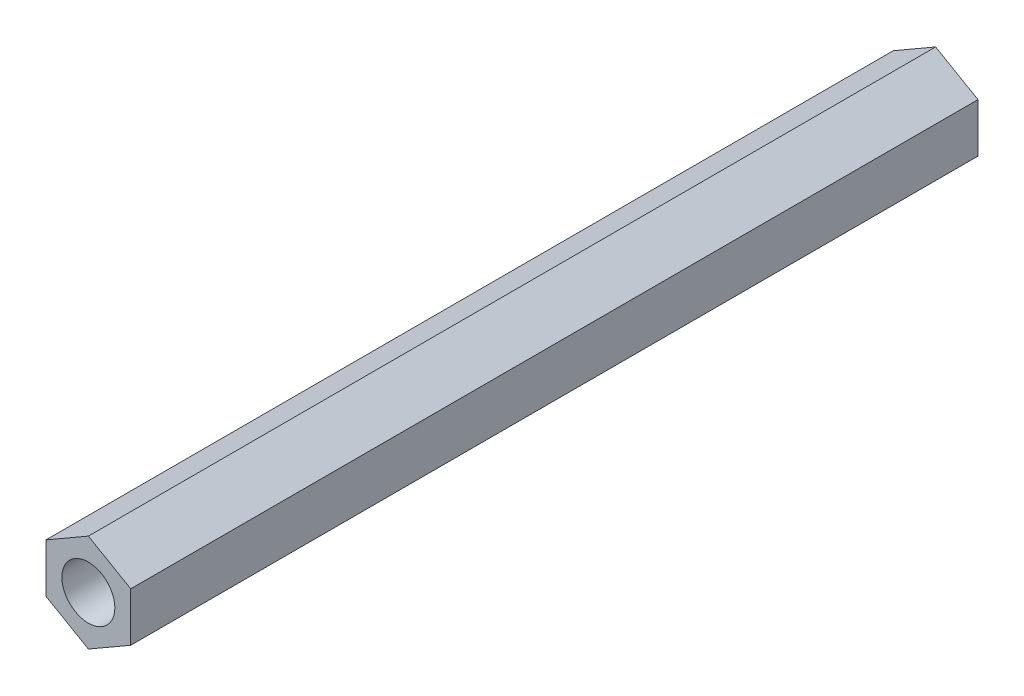
from build123d import *

# Parameters (mm, degrees)
EXTRUDE_1_DEPTH     = 80
SKETCH_2_R          = 2.5
CUT_EXTRUDE_1_DEPTH = 81.232994044


with BuildPart() as part:
    # 草图1 → 凸台-拉伸1 (new body)
    with BuildSketch(Plane.XY):
        Polygon((4, -2.309401077), (4, 2.309401077), (0, 4.618802154), (-4, 2.309401077), (-4, -2.309401077), (0, -4.618802154), align=None)
    extrude(amount=EXTRUDE_1_DEPTH)

    # 草图2 → 切除-拉伸1 (cut, through all)
    with BuildSketch(Plane.XY.offset(80)):
        Circle(SKETCH_2_R)
    extrude(amount=-CUT_EXTRUDE_1_DEPTH, mode=Mode.SUBTRACT)


solid = part.part
